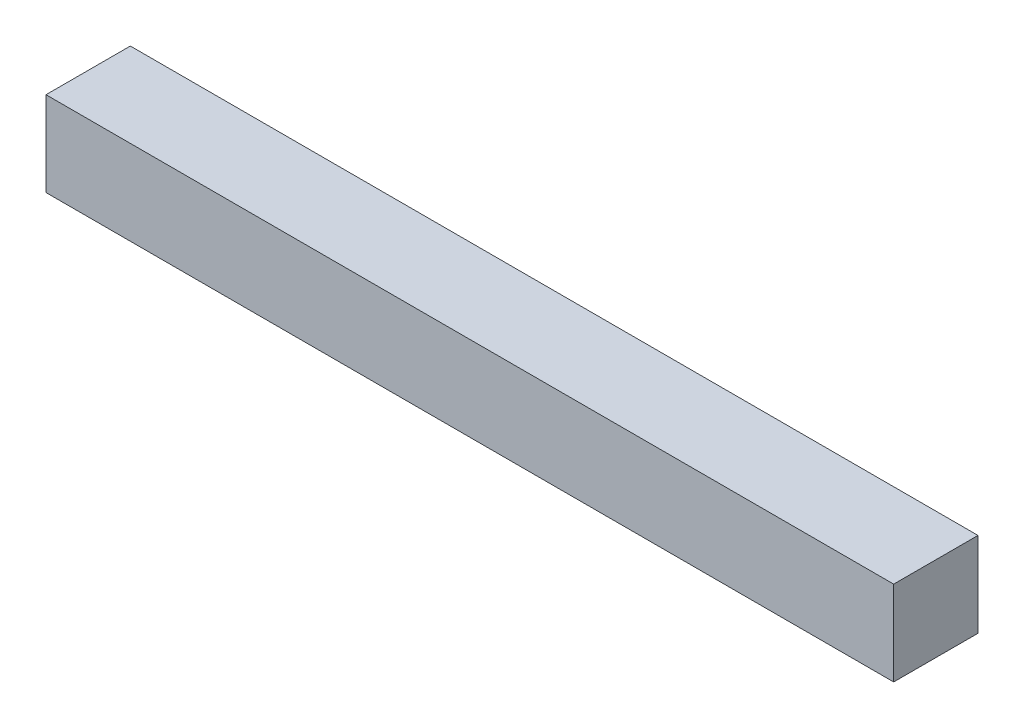
from build123d import *

# Parameters (mm, degrees)
SKETCH1_W           = 190.5
SKETCH1_H           = 18.95073924
BOSS_EXTRUDE1_DEPTH = 19.05


with BuildPart() as part:
    # Sketch1 → Boss-Extrude1 (new body)
    with BuildSketch(Plane(origin=(0, 0, 0), x_dir=(1, 0, 0), z_dir=(0, 1, 0))):
        with Locations((95.25, 9.47536962)):
            Rectangle(SKETCH1_W, SKETCH1_H)
    extrude(amount=BOSS_EXTRUDE1_DEPTH)


solid = part.part
